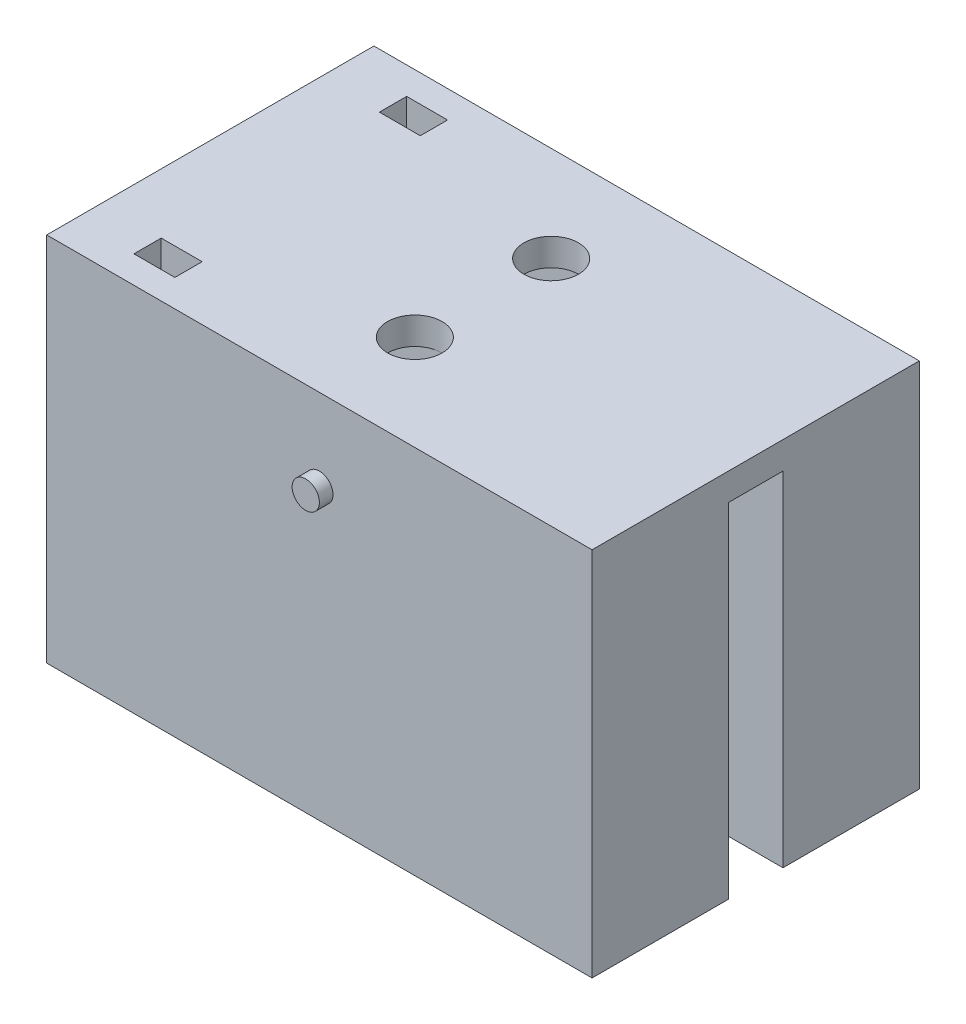
from build123d import *

# Parameters (mm, degrees)
SKETCH_1_W          = 200
SKETCH_1_H          = 120
SKETCH_1_R          = 10
SKETCH_1_W_2        = 15
SKETCH_1_H_2        = 10
EXTRUDE_1_DEPTH     = 10
SKETCH_2_W          = 200
SKETCH_2_H          = 120
SKETCH_2_W_2        = 180
SKETCH_2_H_2        = 100
EXTRUDE_2_DEPTH     = 116
SKETCH_4_W          = 200
SKETCH_4_H          = 120
EXTRUDE_3_DEPTH     = 10
SKETCH_6_W          = 200
SKETCH_6_H          = 20
CUT_EXTRUDE_1_DEPTH = 126
SKETCH_7_W          = 200
SKETCH_7_H          = 126
EXTRUDE_4_DEPTH     = 5
SKETCH_8_W          = 200
SKETCH_8_H          = 126
EXTRUDE_5_DEPTH     = 5
SKETCH_9_R          = 8
EXTRUDE_6_DEPTH     = 20
SKETCH_10_R         = 5
EXTRUDE_7_DEPTH     = 5
EXTRUDE_START       = 5
SKETCH_11_R         = 5
EXTRUDE_8_DEPTH     = 5


with BuildPart() as part:
    # 草图1 → 凸台-拉伸1 (new body)
    with BuildSketch(Plane(origin=(0, 0, 0), x_dir=(1, 0, 0), z_dir=(0, 1, 0))):
        Rectangle(SKETCH_1_W, SKETCH_1_H)
        with Locations(Location((0, 25, 0), (0, 0, 270))):
            Circle(SKETCH_1_R, mode=Mode.SUBTRACT)
        with Locations(Location((0, -25, 0), (0, 0, 90))):
            Circle(SKETCH_1_R, mode=Mode.SUBTRACT)
        with Locations((-70.5, 45)):
            Rectangle(SKETCH_1_W_2, SKETCH_1_H_2, mode=Mode.SUBTRACT)
        with Locations((-70.5, -45)):
            Rectangle(SKETCH_1_W_2, SKETCH_1_H_2, mode=Mode.SUBTRACT)
    extrude(amount=EXTRUDE_1_DEPTH)

    # 草图2 → 凸台-拉伸2 (add)
    with BuildSketch(Plane.XZ):
        Rectangle(SKETCH_2_W, SKETCH_2_H)
        Rectangle(SKETCH_2_W_2, SKETCH_2_H_2, mode=Mode.SUBTRACT)
    extrude(amount=EXTRUDE_2_DEPTH)

    # 草图4 → 凸台-拉伸3 (add)
    with BuildSketch(Plane.XZ.offset(116)):
        Rectangle(SKETCH_4_W, SKETCH_4_H)
    extrude(amount=EXTRUDE_3_DEPTH)

    # 草图6 → 切除-拉伸1 (cut)
    with BuildSketch(Plane.XZ.offset(126)):
        Rectangle(SKETCH_6_W, SKETCH_6_H)
    extrude(amount=-CUT_EXTRUDE_1_DEPTH, mode=Mode.SUBTRACT)

    # 草图7 → 凸台-拉伸4 (add)
    with BuildSketch(Plane(origin=(0, 0, 10), x_dir=(-1, 0, 0), z_dir=(0, 0, -1))):
        with Locations((0, -63)):
            Rectangle(SKETCH_7_W, SKETCH_7_H)
    extrude(amount=-EXTRUDE_4_DEPTH)

    # 草图8 → 凸台-拉伸5 (add)
    with BuildSketch(Plane.XY.offset(-10)):
        with Locations((0, -63)):
            Rectangle(SKETCH_8_W, SKETCH_8_H)
    extrude(amount=-EXTRUDE_5_DEPTH)

    # 草图9 → 凸台-拉伸6 (add)
    with BuildSketch(Plane.XY.offset(-10)):
        with Locations(Location((0, -20, 0), (0, 0, 180))):
            Circle(SKETCH_9_R)
    extrude(amount=EXTRUDE_6_DEPTH)

    # 草图10 → 凸台-拉伸7 (add)
    with BuildSketch(Plane.XY.offset(60)):
        with Locations(Location((0, -20, 0), (0, 0, 180))):
            Circle(SKETCH_10_R)
    extrude(amount=EXTRUDE_7_DEPTH)

    # 草图11 → 凸台-拉伸8 (add)
    with BuildSketch(Plane(origin=(0, 0, -60), x_dir=(-1, 0, 0), z_dir=(0, 0, -1)).offset(EXTRUDE_START)):
        with Locations((0, -20)):
            Circle(SKETCH_11_R)
    extrude(amount=-EXTRUDE_8_DEPTH)


solid = part.part
